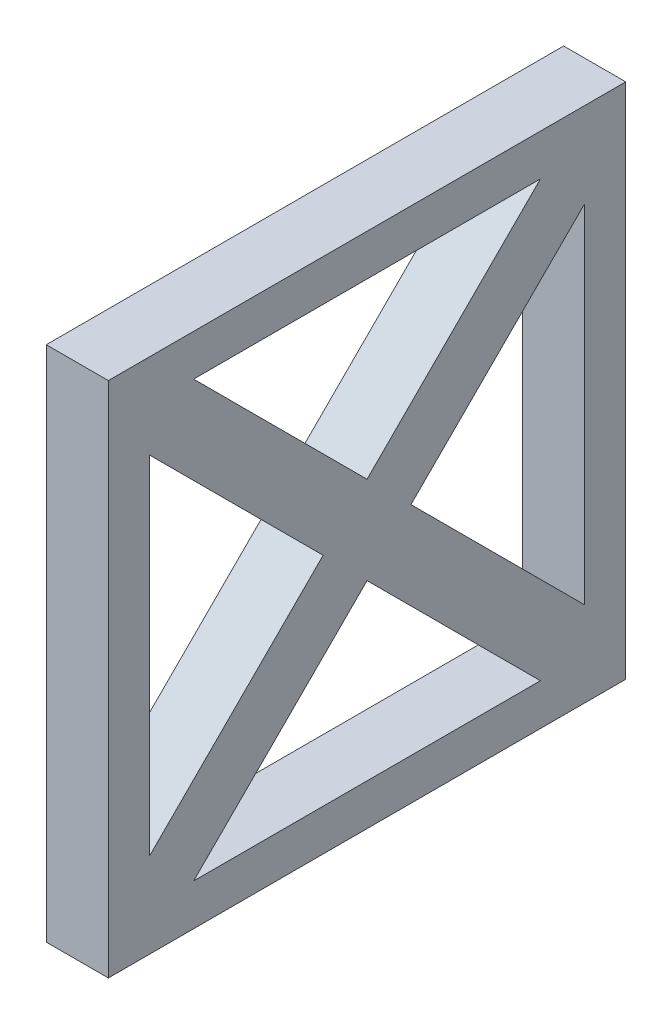
from build123d import *

# Parameters (mm, degrees)
SKETCH1_W           = 50
SKETCH1_H           = 50
BOSS_EXTRUDE1_DEPTH = 6


with BuildPart() as part:
    # Sketch1 → Boss-Extrude1 (new body)
    with BuildSketch(Plane.YZ):
        Rectangle(SKETCH1_W, SKETCH1_H)
        Polygon((4.242640687, 0), (21, 16.757359313), (21, -16.757359313), align=None, mode=Mode.SUBTRACT)
        Polygon((16.757359313, 21), (0, 4.242640687), (-16.757359313, 21), align=None, mode=Mode.SUBTRACT)
        Polygon((-21, 16.757359313), (-4.242640687, 0), (-21, -16.757359313), align=None, mode=Mode.SUBTRACT)
        Polygon((-16.757359313, -21), (0, -4.242640687), (16.757359313, -21), align=None, mode=Mode.SUBTRACT)
    extrude(amount=BOSS_EXTRUDE1_DEPTH)


solid = part.part
